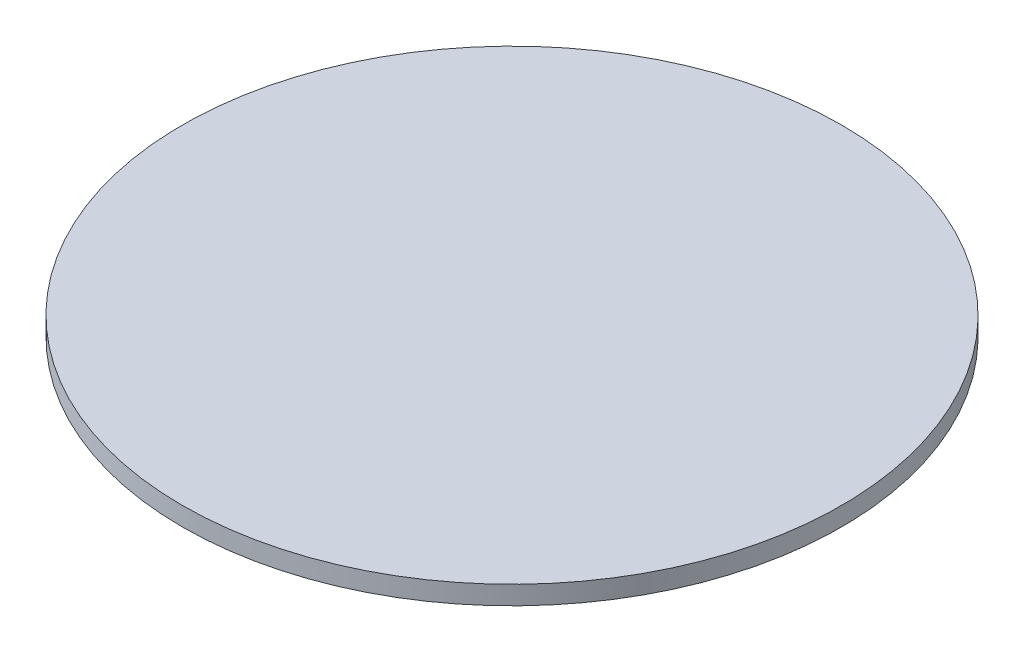
from build123d import *

# Parameters (mm, degrees)
SKETCH1_R           = 3
BOSS_EXTRUDE1_DEPTH = 0.17


with BuildPart() as part:
    # Sketch1 → Boss-Extrude1 (new body)
    with BuildSketch(Plane(origin=(0, 0, 0), x_dir=(1, 0, 0), z_dir=(0, 1, 0))):
        with Locations(Location((0, 0, 0), (0, 0, 270))):
            Circle(SKETCH1_R)
    extrude(amount=BOSS_EXTRUDE1_DEPTH)


solid = part.part
